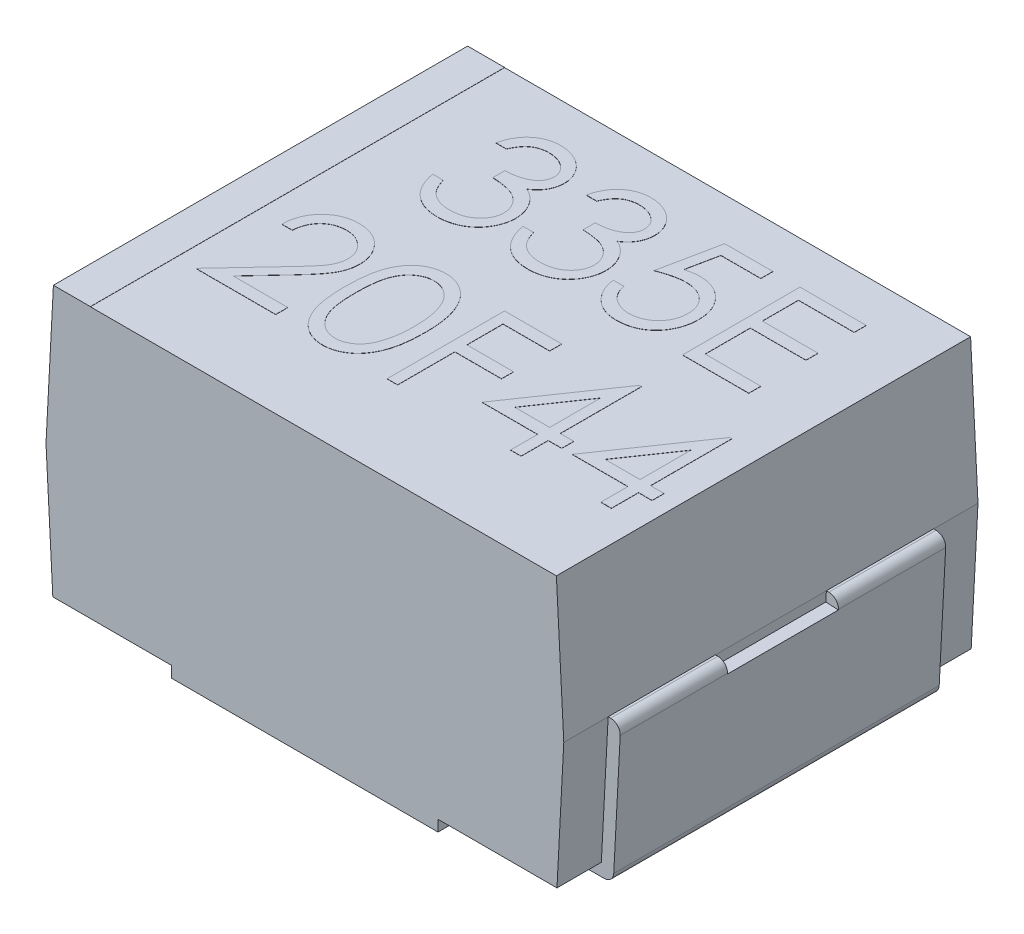
from build123d import *

# Parameters (mm, degrees)
BOSS_EXTRUDE1_DEPTH   = 1.4
CUT_EXTRUDE1_REACH    = 5.436
BOSS_EXTRUDE2_DEPTH   = 1.1
CUT_EXTRUDE2_REACH    = 5.98
SKETCH4_W             = 1.3
SKETCH4_H             = 1.2
SKETCH5_W             = 0.25
SKETCH5_H             = 2.8
BOSS_EXTRUDE3_DEPTH   = 0.00125
BOSS_EXTRUDE4_DEPTH   = 0.00125
BOSS_EXTRUDE4_2_DEPTH = 0.00125
BOSS_EXTRUDE4_3_DEPTH = 0.00125
BOSS_EXTRUDE4_4_DEPTH = 0.00125
BOSS_EXTRUDE5_DEPTH   = 0.00125
BOSS_EXTRUDE5_2_DEPTH = 0.00125
BOSS_EXTRUDE5_3_DEPTH = 0.00125
BOSS_EXTRUDE5_4_DEPTH = 0.00125
BOSS_EXTRUDE5_5_DEPTH = 0.00125
CUT_EXTRUDE3_REACH    = 5.98
SKETCH8_W             = 0.75
SKETCH8_H             = 0.135


with BuildPart() as part:
    # Sketch1 → Boss-Extrude1 (new, symmetric)
    with BuildSketch(Plane.XY):
        Polygon((-1.7, 0.95), (1.7, 0.95), (1.75, 0), (1.7, -0.95), (-1.7, -0.95), (-1.75, 0), align=None)
    extrude(amount=BOSS_EXTRUDE1_DEPTH, both=True)

    # Sketch2 → Cut-Extrude1 (cut, up to next)
    with BuildSketch(Plane.XY.offset(1.4), mode=Mode.PRIVATE) as cut_extrude1_sk1:
        Polygon((-1.7, -0.95), (-0.9, -0.95), (-0.9, -0.875), (-1.703947368, -0.875), align=None)
    cut_extrude1_tool1 = extrude(cut_extrude1_sk1.sketch, amount=-CUT_EXTRUDE1_REACH, mode=Mode.PRIVATE) & part.part
    # Sketch2 → Cut-Extrude1 (cut, up to next)
    with BuildSketch(Plane.XY.offset(1.4), mode=Mode.PRIVATE) as cut_extrude1_sk2:
        Polygon((1.7, -0.95), (0.9, -0.95), (0.9, -0.875), (1.703947368, -0.875), align=None)
    cut_extrude1_tool2 = extrude(cut_extrude1_sk2.sketch, amount=-CUT_EXTRUDE1_REACH, mode=Mode.PRIVATE) & part.part
    add(cut_extrude1_tool1.solids().sort_by_distance((-1.300988, -0.912469, 1.4))[0], mode=Mode.SUBTRACT)
    add(cut_extrude1_tool2.solids().sort_by_distance((1.300988, -0.912469, 1.4))[0], mode=Mode.SUBTRACT)

    # Sketch5 → Boss-Extrude3 (add)
    with BuildSketch(Plane(origin=(0, 0.95, 0), x_dir=(1, 0, 0), z_dir=(0, 1, 0))):
        with Locations((-1.575, 0)):
            Rectangle(SKETCH5_W, SKETCH5_H)
    extrude(amount=BOSS_EXTRUDE3_DEPTH)


with BuildPart() as body_2:
    # Sketch3 → Boss-Extrude2 (new, symmetric)
    with BuildSketch(Plane.XY):
        with BuildLine():
            Line((-1.75, 0), (-1.703947368, -0.875))
            Line((-1.703947368, -0.875), (-0.94, -0.875))
            Line((-0.94, -0.875), (-0.94, -0.895))
            ThreePointArc((-0.94, -0.895), (-0.959038059, -0.940961941), (-1.005, -0.96))
            Line((-1.005, -0.96), (-1.722804771, -0.96))
            ThreePointArc((-1.722804771, -0.96), (-1.767542557, -0.942154327), (-1.78771493, -0.898416324))
            Line((-1.78771493, -0.898416324), (-1.831399141, -0.068416324))
            ThreePointArc((-1.831399141, -0.068416324), (-1.813643309, -0.020262214), (-1.766488982, 0))
            Line((-1.766488982, 0), (-1.75, 0))
        make_face()
    extrude(amount=BOSS_EXTRUDE2_DEPTH, both=True)


with BuildPart() as body_3:
    # Mirror1: mirrored copy
    add(body_2.part.mirror(Plane(origin=(0, 0, 0), x_dir=(0, 0, 1), z_dir=(1, 0, 0))))

    # Cut-Extrude3: up to this face of the body (flat: up to its plane)
    cut_extrude3_end = Plane(body_3.part.faces().sort_by_distance((1.809557036, -0.483416324, 0))[0])
    # Sketch8 → Cut-Extrude3 (cut, up to the picked face)
    with BuildSketch(Plane(origin=(1.745165746, -0.091850829, 0), x_dir=(0, 0, -1), z_dir=(0.9986178293325098, -0.052558833122763125, 0)), mode=Mode.PRIVATE) as cut_extrude3_sk1:
        with Locations((0, 0.091977958)):
            Rectangle(SKETCH8_W, SKETCH8_H)
    cut_extrude3_tool1 = split(extrude(cut_extrude3_sk1.sketch, amount=CUT_EXTRUDE3_REACH, mode=Mode.PRIVATE), bisect_by=cut_extrude3_end, keep=Keep.BOTH, mode=Mode.PRIVATE)
    add(cut_extrude3_tool1.solids().sort_by(Axis((1.75, 0, 0), (0.9986178293325098, -0.052558833122763125, 0)))[0], mode=Mode.SUBTRACT)


with BuildPart() as body_2_1:
    add(body_2.part)

    # Cut-Extrude2: up to this face of the body (flat: up to its plane)
    cut_extrude2_end = Plane(body_2_1.part.faces().sort_by_distance((-1.809557036, -0.483416324, 0))[0])
    # Sketch4 → Cut-Extrude2 (cut, up to the picked face)
    with BuildSketch(Plane(origin=(-1.745165746, -0.091850829, 0), x_dir=(0, 0, 1), z_dir=(-0.9986178293325095, -0.052558833122767205, 0)), mode=Mode.PRIVATE) as cut_extrude2_sk1:
        with Locations((0, 0.091977958)):
            Rectangle(SKETCH4_W, SKETCH4_H)
    cut_extrude2_tool1 = split(extrude(cut_extrude2_sk1.sketch, amount=CUT_EXTRUDE2_REACH, mode=Mode.PRIVATE), bisect_by=cut_extrude2_end, keep=Keep.BOTH, mode=Mode.PRIVATE)
    add(cut_extrude2_tool1.solids().sort_by(Axis((-1.75, 0, 0), (-0.9986178293325095, -0.052558833122767205, 0)))[0], mode=Mode.SUBTRACT)


with BuildPart() as body_4:
    # Sketch6 → Boss-Extrude4 (new body)
    with BuildSketch(Plane(origin=(0, 0.95, 0), x_dir=(1, 0, 0), z_dir=(0, 1, 0))):
        with BuildLine():
            Line((-0.966810017, 0.929044549), (-1.038043992, 0.929044549))
            add(Edge.make_bspline(
                [(-1.038043992, 0.929044549), (-1.036114147, 0.937034773), (-1.032341459, 0.952655007), (-1.024472545, 0.974972368), (-1.015900214, 0.996091453), (-1.005606613, 1.015616812), (-0.994378735, 1.033940849), (-0.981514832, 1.050647954), (-0.967608395, 1.066163037), (-0.952226666, 1.079931932), (-0.936095701, 1.092400096), (-0.918988207, 1.103030689), (-0.901248372, 1.112175631), (-0.882753287, 1.119709505), (-0.863447887, 1.125384936), (-0.843506705, 1.12950264), (-0.822877482, 1.132176697), (-0.808874011, 1.132437673), (-0.801763443, 1.13257019)],
                knots=[0, 0, 0, 0, 1.162005537, 2.271625781, 3.343758855, 4.383309926, 5.390229558, 6.379919256, 7.361854164, 8.333198761, 9.295911338, 10.242430842, 11.177959212, 12.116337295, 13.062827104, 14.020064771, 14.994644689, 16, 16, 16, 16], degree=3))
            add(Edge.make_bspline(
                [(-0.801763443, 1.13257019), (-0.791403249, 1.1322574), (-0.770908849, 1.131638644), (-0.740800086, 1.125988405), (-0.711765433, 1.117047348), (-0.684122693, 1.104693485), (-0.658446369, 1.089456363), (-0.635600841, 1.071321503), (-0.615895768, 1.050638804), (-0.599364365, 1.027794097), (-0.58642057, 1.003379366), (-0.576875982, 0.978251473), (-0.571065351, 0.952470026), (-0.570312296, 0.935062571), (-0.569935017, 0.926341474)],
                knots=[0, 0, 0, 0, 1.083050992, 2.142477498, 3.193116406, 4.255571735, 5.30263384, 6.308962982, 7.297363603, 8.282367274, 9.249857812, 10.179914175, 11.08814088, 12, 12, 12, 12], degree=3))
            add(Edge.make_bspline(
                [(-0.569935017, 0.926341474), (-0.570198903, 0.917948862), (-0.570715287, 0.901525821), (-0.575099895, 0.877549696), (-0.582478655, 0.854952405), (-0.592699833, 0.83363882), (-0.605930863, 0.813744079), (-0.621958421, 0.795223422), (-0.640895632, 0.777994702), (-0.655246391, 0.768125107), (-0.662634587, 0.763043948)],
                knots=[0, 0, 0, 0, 1.024540389, 2.004866551, 2.965041327, 3.920577974, 4.882998113, 5.874504559, 6.905732034, 8, 8, 8, 8], degree=3))
            add(Edge.make_bspline(
                [(-0.662634587, 0.763043948), (-0.654190956, 0.758966755), (-0.637461683, 0.750888658), (-0.61465826, 0.73504637), (-0.593957741, 0.716754663), (-0.582413505, 0.702480168), (-0.576613202, 0.69530807)],
                knots=[0, 0, 0, 0, 1.015518401, 2.012035669, 3.001164323, 4, 4, 4, 4], degree=3))
            add(Edge.make_bspline(
                [(-0.576613202, 0.69530807), (-0.572793826, 0.690078902), (-0.56521762, 0.679706196), (-0.55586599, 0.663029185), (-0.547382137, 0.646167329), (-0.540771284, 0.628668678), (-0.535651853, 0.610736048), (-0.531992432, 0.592338648), (-0.5297191, 0.573461453), (-0.529393537, 0.560690587), (-0.529229889, 0.554271161)],
                knots=[0, 0, 0, 0, 1.025084078, 2.033381695, 3.024893161, 4.013698104, 4.991890475, 5.976764909, 6.982997093, 8, 8, 8, 8], degree=3))
            add(Edge.make_bspline(
                [(-0.529229889, 0.554271161), (-0.529636859, 0.543156457), (-0.530448884, 0.520979353), (-0.537706951, 0.488214551), (-0.548958525, 0.456186624), (-0.564937152, 0.42555358), (-0.584410676, 0.396892315), (-0.607578498, 0.371248224), (-0.634177379, 0.349204969), (-0.663842232, 0.330787649), (-0.695981652, 0.316065192), (-0.730356831, 0.305846808), (-0.766472468, 0.299191554), (-0.791239123, 0.298477889), (-0.8038305, 0.298115062)],
                knots=[0, 0, 0, 0, 0.955779014, 1.907060117, 2.875433937, 3.871313158, 4.872415639, 5.851225146, 6.836215519, 7.83643374, 8.849228613, 9.86973379, 10.916971861, 12, 12, 12, 12], degree=3))
            add(Edge.make_bspline(
                [(-0.8038305, 0.298115062), (-0.812316663, 0.29831196), (-0.829014601, 0.29869939), (-0.85356268, 0.30134793), (-0.876994566, 0.306185271), (-0.899341939, 0.31269477), (-0.920624652, 0.320947898), (-0.940777762, 0.331225531), (-0.959925256, 0.343315818), (-0.977886446, 0.357361471), (-0.994659193, 0.373073489), (-1.009797757, 0.3907308), (-1.023554532, 0.410006997), (-1.035561166, 0.431125976), (-1.046364546, 0.453814811), (-1.055250227, 0.478364024), (-1.063071062, 0.504554151), (-1.066707222, 0.522805352), (-1.068572838, 0.532169549)],
                knots=[0, 0, 0, 0, 1.048658725, 2.063410685, 3.046034179, 4.001477787, 4.936774919, 5.862367409, 6.792675028, 7.730719943, 8.675894397, 9.627829632, 10.600096036, 11.597688215, 12.626045268, 13.701542398, 14.82072376, 16, 16, 16, 16], degree=3))
            Line((-1.068572838, 0.532169549), (-0.997338863, 0.532169549))
            add(Edge.make_bspline(
                [(-0.997338863, 0.532169549), (-0.99548301, 0.526057898), (-0.991873213, 0.514170205), (-0.985728614, 0.497061421), (-0.97872813, 0.481377363), (-0.971218222, 0.467002976), (-0.963330967, 0.453796699), (-0.954505618, 0.44210774), (-0.94539583, 0.431422685), (-0.938528905, 0.425402746), (-0.93516814, 0.422456508)],
                knots=[0, 0, 0, 0, 1.198163088, 2.33053128, 3.407730985, 4.417276592, 5.372219308, 6.28897303, 7.162600585, 8, 8, 8, 8], degree=3))
            add(Edge.make_bspline(
                [(-0.93516814, 0.422456508), (-0.930723917, 0.419030154), (-0.921849188, 0.412188021), (-0.907387464, 0.403456402), (-0.892178106, 0.395890598), (-0.875891564, 0.39011126), (-0.858879285, 0.385217755), (-0.840866294, 0.382015423), (-0.822011507, 0.379818284), (-0.809137389, 0.379624398), (-0.802558465, 0.379525318)],
                knots=[0, 0, 0, 0, 0.946170439, 1.889420265, 2.845303464, 3.807233317, 4.801018734, 5.828864929, 6.890507805, 8, 8, 8, 8], degree=3))
            add(Edge.make_bspline(
                [(-0.802558465, 0.379525318), (-0.795130438, 0.379664997), (-0.780605574, 0.379938126), (-0.759411347, 0.382449938), (-0.739248408, 0.386108085), (-0.720340619, 0.391757994), (-0.702440308, 0.398738651), (-0.685798398, 0.407503557), (-0.670196424, 0.417787093), (-0.655834219, 0.429475437), (-0.642919792, 0.442271027), (-0.631548866, 0.455654348), (-0.621882202, 0.469568974), (-0.614084498, 0.484091905), (-0.607927141, 0.499163001), (-0.603735415, 0.514824557), (-0.600820875, 0.530948401), (-0.600583518, 0.541908721), (-0.600463863, 0.547433972)],
                knots=[0, 0, 0, 0, 1.217147791, 2.380027433, 3.494444702, 4.572153297, 5.609568379, 6.639424714, 7.649109417, 8.668170816, 9.669597737, 10.625200337, 11.543417969, 12.441394052, 13.322311151, 14.205496177, 15.095365482, 16, 16, 16, 16], degree=3))
            add(Edge.make_bspline(
                [(-0.600463863, 0.547433972), (-0.600810914, 0.554829758), (-0.601503288, 0.569584529), (-0.606789341, 0.591291907), (-0.615484048, 0.61220686), (-0.627656206, 0.631972548), (-0.642473416, 0.650291368), (-0.659791886, 0.666636151), (-0.679755431, 0.680123118), (-0.69812958, 0.689441438), (-0.714404892, 0.695799846), (-0.728333024, 0.700035062), (-0.743926039, 0.703621373), (-0.760995372, 0.706957906), (-0.779669637, 0.709797569), (-0.799928504, 0.712165623), (-0.821776079, 0.714060427), (-0.836900683, 0.714906586), (-0.844694633, 0.715342626)],
                knots=[0, 0, 0, 0, 1.07054697, 2.135767047, 3.216561865, 4.33974944, 5.486079747, 6.621378074, 7.775625952, 8.963672916, 9.598146892, 10.304877434, 11.070270905, 11.915000392, 12.823868403, 13.805723172, 14.86925407, 16, 16, 16, 16], degree=3))
            Line((-0.844694633, 0.715342626), (-0.844694633, 0.796752882))
            add(Edge.make_bspline(
                [(-0.844694633, 0.796752882), (-0.834874547, 0.796919525), (-0.815639411, 0.797245938), (-0.787541953, 0.801193826), (-0.760673898, 0.806654968), (-0.73563069, 0.815020003), (-0.712805, 0.82473557), (-0.693002162, 0.836041339), (-0.676499612, 0.848608613), (-0.663377548, 0.862631365), (-0.653505741, 0.877670671), (-0.646287878, 0.893345341), (-0.642024232, 0.909792762), (-0.641455076, 0.921017446), (-0.641168992, 0.926659483)],
                knots=[0, 0, 0, 0, 1.321986639, 2.589447074, 3.816329219, 5.01088745, 6.139805852, 7.153945165, 8.075214402, 8.924034688, 9.728124013, 10.488707548, 11.240355623, 12, 12, 12, 12], degree=3))
            add(Edge.make_bspline(
                [(-0.641168992, 0.926659483), (-0.641262974, 0.930804614), (-0.641449948, 0.939051157), (-0.643807902, 0.951099163), (-0.647351211, 0.962778842), (-0.652222507, 0.974040524), (-0.658742641, 0.984806104), (-0.666545427, 0.995167365), (-0.675836407, 1.00506515), (-0.686482964, 1.014290866), (-0.697915641, 1.023083175), (-0.710445501, 1.030547518), (-0.723694748, 1.036930416), (-0.73767805, 1.042193999), (-0.752440786, 1.046153516), (-0.767913595, 1.048996466), (-0.78412598, 1.050773934), (-0.795186712, 1.051029843), (-0.800809416, 1.051159933)],
                knots=[0, 0, 0, 0, 0.884392785, 1.759457502, 2.611959086, 3.489218968, 4.37281399, 5.2945488, 6.255912374, 7.266815255, 8.301784654, 9.332968512, 10.37626691, 11.440494194, 12.520033166, 13.637162961, 14.798855837, 16, 16, 16, 16], degree=3))
            add(Edge.make_bspline(
                [(-0.800809416, 1.051159933), (-0.809847205, 1.050844392), (-0.827500109, 1.050228067), (-0.852948849, 1.044829884), (-0.876606984, 1.036216997), (-0.894690574, 1.025936116), (-0.908044301, 1.015787357), (-0.91758675, 1.00692403), (-0.926957651, 0.997074086), (-0.93554051, 0.985630847), (-0.944220501, 0.973369272), (-0.95212275, 0.959666044), (-0.959801644, 0.944878619), (-0.964428651, 0.934424787), (-0.966810017, 0.929044549)],
                knots=[0, 0, 0, 0, 1.472543308, 2.876219568, 4.221790263, 5.565193594, 6.249813518, 6.953379497, 7.687249741, 8.463570142, 9.283606569, 10.136032583, 11.040678096, 12, 12, 12, 12], degree=3))
        make_face()
    extrude(amount=BOSS_EXTRUDE4_DEPTH)


with BuildPart() as body_5:
    # Sketch6 → Boss-Extrude4 2 (new body)
    with BuildSketch(Plane(origin=(0, 0.95, 0), x_dir=(1, 0, 0), z_dir=(0, 1, 0))):
        with BuildLine():
            Line((-0.356233094, 0.929044549), (-0.427467069, 0.929044549))
            add(Edge.make_bspline(
                [(-0.427467069, 0.929044549), (-0.425537224, 0.937034773), (-0.421764536, 0.952655007), (-0.413895622, 0.974972368), (-0.405323291, 0.996091453), (-0.39502969, 1.015616812), (-0.383801812, 1.033940849), (-0.370937909, 1.050647954), (-0.357031472, 1.066163037), (-0.341649742, 1.079931932), (-0.325518778, 1.092400096), (-0.308411284, 1.103030689), (-0.290671449, 1.112175631), (-0.272176364, 1.119709505), (-0.252870964, 1.125384936), (-0.232929782, 1.12950264), (-0.212300559, 1.132176697), (-0.198297088, 1.132437673), (-0.19118652, 1.13257019)],
                knots=[0, 0, 0, 0, 1.162005537, 2.271625781, 3.343758855, 4.383309926, 5.390229558, 6.379919256, 7.361854164, 8.333198761, 9.295911338, 10.242430842, 11.177959212, 12.116337295, 13.062827104, 14.020064771, 14.994644689, 16, 16, 16, 16], degree=3))
            add(Edge.make_bspline(
                [(-0.19118652, 1.13257019), (-0.180826326, 1.1322574), (-0.160331926, 1.131638644), (-0.130223163, 1.125988405), (-0.10118851, 1.117047348), (-0.073545769, 1.104693485), (-0.047869446, 1.089456363), (-0.025023918, 1.071321503), (-0.005318845, 1.050638804), (0.011212558, 1.027794097), (0.024156353, 1.003379366), (0.033700941, 0.978251473), (0.039511572, 0.952470026), (0.040264627, 0.935062571), (0.040641906, 0.926341474)],
                knots=[0, 0, 0, 0, 1.083050992, 2.142477498, 3.193116406, 4.255571735, 5.30263384, 6.308962982, 7.297363603, 8.282367274, 9.249857812, 10.179914175, 11.08814088, 12, 12, 12, 12], degree=3))
            add(Edge.make_bspline(
                [(0.040641906, 0.926341474), (0.04037802, 0.917948862), (0.039861636, 0.901525821), (0.035477028, 0.877549696), (0.028098269, 0.854952405), (0.01787709, 0.83363882), (0.00464606, 0.813744079), (-0.011381498, 0.795223422), (-0.030318709, 0.777994702), (-0.044669468, 0.768125107), (-0.052057663, 0.763043948)],
                knots=[0, 0, 0, 0, 1.024540389, 2.004866551, 2.965041327, 3.920577974, 4.882998113, 5.874504559, 6.905732034, 8, 8, 8, 8], degree=3))
            add(Edge.make_bspline(
                [(-0.052057663, 0.763043948), (-0.043614033, 0.758966755), (-0.02688476, 0.750888658), (-0.004081336, 0.73504637), (0.016619182, 0.716754663), (0.028163418, 0.702480168), (0.033963721, 0.69530807)],
                knots=[0, 0, 0, 0, 1.015518401, 2.012035669, 3.001164323, 4, 4, 4, 4], degree=3))
            add(Edge.make_bspline(
                [(0.033963721, 0.69530807), (0.037783097, 0.690078902), (0.045359303, 0.679706196), (0.054710933, 0.663029185), (0.063194786, 0.646167329), (0.069805639, 0.628668678), (0.07492507, 0.610736048), (0.078584492, 0.592338648), (0.080857823, 0.573461453), (0.081183386, 0.560690587), (0.081347034, 0.554271161)],
                knots=[0, 0, 0, 0, 1.025084078, 2.033381695, 3.024893161, 4.013698104, 4.991890475, 5.976764909, 6.982997093, 8, 8, 8, 8], degree=3))
            add(Edge.make_bspline(
                [(0.081347034, 0.554271161), (0.080940064, 0.543156457), (0.080128039, 0.520979353), (0.072869972, 0.488214551), (0.061618398, 0.456186624), (0.045639772, 0.42555358), (0.026166247, 0.396892315), (0.002998425, 0.371248224), (-0.023600456, 0.349204969), (-0.053265309, 0.330787649), (-0.085404729, 0.316065192), (-0.119779908, 0.305846808), (-0.155895545, 0.299191554), (-0.1806622, 0.298477889), (-0.193253577, 0.298115062)],
                knots=[0, 0, 0, 0, 0.955779014, 1.907060117, 2.875433937, 3.871313158, 4.872415639, 5.851225146, 6.836215519, 7.83643374, 8.849228613, 9.86973379, 10.916971861, 12, 12, 12, 12], degree=3))
            add(Edge.make_bspline(
                [(-0.193253577, 0.298115062), (-0.20173974, 0.29831196), (-0.218437678, 0.29869939), (-0.242985757, 0.30134793), (-0.266417643, 0.306185271), (-0.288765016, 0.31269477), (-0.310047729, 0.320947898), (-0.330200839, 0.331225531), (-0.349348333, 0.343315818), (-0.367309523, 0.357361471), (-0.38408227, 0.373073489), (-0.399220834, 0.3907308), (-0.412977609, 0.410006997), (-0.424984243, 0.431125976), (-0.435787623, 0.453814811), (-0.444673304, 0.478364024), (-0.452494139, 0.504554151), (-0.456130299, 0.522805352), (-0.457995915, 0.532169549)],
                knots=[0, 0, 0, 0, 1.048658725, 2.063410685, 3.046034179, 4.001477787, 4.936774919, 5.862367409, 6.792675028, 7.730719943, 8.675894397, 9.627829632, 10.600096036, 11.597688215, 12.626045268, 13.701542398, 14.82072376, 16, 16, 16, 16], degree=3))
            Line((-0.457995915, 0.532169549), (-0.38676194, 0.532169549))
            add(Edge.make_bspline(
                [(-0.38676194, 0.532169549), (-0.384906087, 0.526057898), (-0.38129629, 0.514170205), (-0.375151691, 0.497061421), (-0.368151207, 0.481377363), (-0.360641299, 0.467002976), (-0.352754044, 0.453796699), (-0.343928695, 0.44210774), (-0.334818906, 0.431422685), (-0.327951982, 0.425402746), (-0.324591217, 0.422456508)],
                knots=[0, 0, 0, 0, 1.198163088, 2.33053128, 3.407730985, 4.417276592, 5.372219308, 6.28897303, 7.162600585, 8, 8, 8, 8], degree=3))
            add(Edge.make_bspline(
                [(-0.324591217, 0.422456508), (-0.320146994, 0.419030154), (-0.311272265, 0.412188021), (-0.296810541, 0.403456402), (-0.281601183, 0.395890598), (-0.265314641, 0.39011126), (-0.248302362, 0.385217755), (-0.23028937, 0.382015423), (-0.211434584, 0.379818284), (-0.198560466, 0.379624398), (-0.191981542, 0.379525318)],
                knots=[0, 0, 0, 0, 0.946170439, 1.889420265, 2.845303464, 3.807233317, 4.801018734, 5.828864929, 6.890507805, 8, 8, 8, 8], degree=3))
            add(Edge.make_bspline(
                [(-0.191981542, 0.379525318), (-0.184553515, 0.379664997), (-0.170028651, 0.379938126), (-0.148834424, 0.382449938), (-0.128671485, 0.386108085), (-0.109763696, 0.391757994), (-0.091863385, 0.398738651), (-0.075221475, 0.407503557), (-0.059619501, 0.417787093), (-0.045257296, 0.429475437), (-0.032342869, 0.442271027), (-0.020971943, 0.455654348), (-0.011305279, 0.469568974), (-0.003507575, 0.484091905), (0.002649782, 0.499163001), (0.006841508, 0.514824557), (0.009756048, 0.530948401), (0.009993405, 0.541908721), (0.01011306, 0.547433972)],
                knots=[0, 0, 0, 0, 1.217147791, 2.380027433, 3.494444702, 4.572153297, 5.609568379, 6.639424714, 7.649109417, 8.668170816, 9.669597737, 10.625200337, 11.543417969, 12.441394052, 13.322311151, 14.205496177, 15.095365482, 16, 16, 16, 16], degree=3))
            add(Edge.make_bspline(
                [(0.01011306, 0.547433972), (0.009766009, 0.554829758), (0.009073635, 0.569584529), (0.003787582, 0.591291907), (-0.004907125, 0.61220686), (-0.017079283, 0.631972548), (-0.031896493, 0.650291368), (-0.049214963, 0.666636151), (-0.069178508, 0.680123118), (-0.087552657, 0.689441438), (-0.103827969, 0.695799846), (-0.117756101, 0.700035062), (-0.133349116, 0.703621373), (-0.150418449, 0.706957906), (-0.169092714, 0.709797569), (-0.189351581, 0.712165623), (-0.211199156, 0.714060427), (-0.226323759, 0.714906586), (-0.23411771, 0.715342626)],
                knots=[0, 0, 0, 0, 1.07054697, 2.135767047, 3.216561865, 4.33974944, 5.486079747, 6.621378074, 7.775625952, 8.963672916, 9.598146892, 10.304877434, 11.070270905, 11.915000392, 12.823868403, 13.805723172, 14.86925407, 16, 16, 16, 16], degree=3))
            Line((-0.23411771, 0.715342626), (-0.23411771, 0.796752882))
            add(Edge.make_bspline(
                [(-0.23411771, 0.796752882), (-0.224297624, 0.796919525), (-0.205062488, 0.797245938), (-0.17696503, 0.801193826), (-0.150096975, 0.806654968), (-0.125053767, 0.815020003), (-0.102228077, 0.82473557), (-0.082425239, 0.836041339), (-0.065922689, 0.848608613), (-0.052800625, 0.862631365), (-0.042928818, 0.877670671), (-0.035710955, 0.893345341), (-0.031447309, 0.909792762), (-0.030878153, 0.921017446), (-0.030592069, 0.926659483)],
                knots=[0, 0, 0, 0, 1.321986639, 2.589447074, 3.816329219, 5.01088745, 6.139805852, 7.153945165, 8.075214402, 8.924034688, 9.728124013, 10.488707548, 11.240355623, 12, 12, 12, 12], degree=3))
            add(Edge.make_bspline(
                [(-0.030592069, 0.926659483), (-0.030686051, 0.930804614), (-0.030873025, 0.939051157), (-0.033230979, 0.951099163), (-0.036774288, 0.962778842), (-0.041645584, 0.974040524), (-0.048165718, 0.984806104), (-0.055968504, 0.995167365), (-0.065259484, 1.00506515), (-0.075906041, 1.014290866), (-0.087338718, 1.023083175), (-0.099868578, 1.030547518), (-0.113117824, 1.036930416), (-0.127101127, 1.042193999), (-0.141863863, 1.046153516), (-0.157336672, 1.048996466), (-0.173549057, 1.050773934), (-0.184609789, 1.051029843), (-0.190232493, 1.051159933)],
                knots=[0, 0, 0, 0, 0.884392785, 1.759457502, 2.611959086, 3.489218968, 4.37281399, 5.2945488, 6.255912374, 7.266815255, 8.301784654, 9.332968512, 10.37626691, 11.440494194, 12.520033166, 13.637162961, 14.798855837, 16, 16, 16, 16], degree=3))
            add(Edge.make_bspline(
                [(-0.190232493, 1.051159933), (-0.199270282, 1.050844392), (-0.216923186, 1.050228067), (-0.242371926, 1.044829884), (-0.266030061, 1.036216997), (-0.284113651, 1.025936116), (-0.297467378, 1.015787357), (-0.307009826, 1.00692403), (-0.316380728, 0.997074086), (-0.324963587, 0.985630847), (-0.333643578, 0.973369272), (-0.341545827, 0.959666044), (-0.349224721, 0.944878619), (-0.353851728, 0.934424787), (-0.356233094, 0.929044549)],
                knots=[0, 0, 0, 0, 1.472543308, 2.876219568, 4.221790263, 5.565193594, 6.249813518, 6.953379497, 7.687249741, 8.463570142, 9.283606569, 10.136032583, 11.040678096, 12, 12, 12, 12], degree=3))
        make_face()
    extrude(amount=BOSS_EXTRUDE4_2_DEPTH)


with BuildPart() as body_6:
    # Sketch6 → Boss-Extrude4 3 (new body)
    with BuildSketch(Plane(origin=(0, 0.95, 0), x_dir=(1, 0, 0), z_dir=(0, 1, 0))):
        with BuildLine():
            Line((0.651218829, 1.112217626), (0.651218829, 1.030807369))
            Line((0.651218829, 1.030807369), (0.381229346, 1.030807369))
            Line((0.381229346, 1.030807369), (0.33845716, 0.822034583))
            add(Edge.make_bspline(
                [(0.33845716, 0.822034583), (0.346860903, 0.824354662), (0.363141826, 0.828849449), (0.387172009, 0.833840044), (0.409984883, 0.836848457), (0.424788405, 0.837259236), (0.431951752, 0.83745801)],
                knots=[0, 0, 0, 0, 1.100273476, 2.13160584, 3.095893838, 4, 4, 4, 4], degree=3))
            add(Edge.make_bspline(
                [(0.431951752, 0.83745801), (0.440815385, 0.837266164), (0.458243504, 0.836888947), (0.483743051, 0.833266759), (0.508084618, 0.827565386), (0.531217298, 0.819600553), (0.553183887, 0.809415667), (0.573782281, 0.796693002), (0.593321665, 0.781830979), (0.611451503, 0.764743807), (0.62789898, 0.745938369), (0.642360195, 0.725718637), (0.654643497, 0.704281114), (0.664522454, 0.681420976), (0.672411044, 0.657390953), (0.677661586, 0.631938207), (0.681157875, 0.605302651), (0.681548488, 0.587090722), (0.681747675, 0.577803814)],
                knots=[0, 0, 0, 0, 1.052922333, 2.070308379, 3.05430497, 4.020497103, 4.973039431, 5.925935799, 6.892292201, 7.88610001, 8.88166317, 9.857072816, 10.836096531, 11.812156883, 12.81219415, 13.836441305, 14.89672472, 16, 16, 16, 16], degree=3))
            add(Edge.make_bspline(
                [(0.681747675, 0.577803814), (0.681596846, 0.571335382), (0.681297225, 0.558485933), (0.679773545, 0.53940323), (0.676839909, 0.520724516), (0.672901158, 0.502447313), (0.667788859, 0.484606223), (0.661600092, 0.46715018), (0.65402635, 0.450187832), (0.645718877, 0.43355868), (0.636364765, 0.417638661), (0.625982854, 0.402750409), (0.615014251, 0.388670581), (0.603212008, 0.375550181), (0.590466426, 0.363475425), (0.576931862, 0.352374654), (0.562716317, 0.342060138), (0.54759986, 0.332950565), (0.531919332, 0.324567894), (0.51544829, 0.317690949), (0.498561667, 0.311542669), (0.481016419, 0.306641937), (0.462852286, 0.302801875), (0.444039328, 0.300193703), (0.424676212, 0.298294047), (0.411550986, 0.29817513), (0.404921002, 0.298115062)],
                knots=[0, 0, 0, 0, 1.056347294, 2.098418968, 3.122841568, 4.141288669, 5.149314143, 6.15115421, 7.162517403, 8.180376062, 9.185164535, 10.17417709, 11.141909838, 12.097768115, 13.052685741, 14.0056014, 14.954263652, 15.917497458, 16.885230207, 17.854509472, 18.828990115, 19.81800267, 20.826176721, 21.857883937, 22.917946725, 24, 24, 24, 24], degree=3))
            add(Edge.make_bspline(
                [(0.404921002, 0.298115062), (0.397012036, 0.298271734), (0.38145208, 0.298579968), (0.358655452, 0.301804517), (0.336721961, 0.306422762), (0.31582817, 0.313370631), (0.29578683, 0.322076321), (0.276867749, 0.333079095), (0.258587511, 0.345547571), (0.241689245, 0.360261508), (0.226005626, 0.376344172), (0.211966115, 0.393797065), (0.199462607, 0.412332135), (0.188695332, 0.432039395), (0.17951096, 0.452867062), (0.172295775, 0.474893171), (0.166472291, 0.498002636), (0.164008622, 0.51391245), (0.16275729, 0.521993267)],
                knots=[0, 0, 0, 0, 1.0467383, 2.05933395, 3.04377827, 4.011590433, 4.970194871, 5.932262533, 6.905835911, 7.896367577, 8.894135286, 9.877477877, 10.858688626, 11.851381753, 12.8477658, 13.868841284, 14.917554742, 16, 16, 16, 16], degree=3))
            Line((0.16275729, 0.521993267), (0.233991265, 0.521993267))
            add(Edge.make_bspline(
                [(0.233991265, 0.521993267), (0.235743991, 0.514423964), (0.239112829, 0.499875344), (0.246507347, 0.479434844), (0.255548358, 0.461219591), (0.266298987, 0.444988632), (0.279123726, 0.430835163), (0.293758078, 0.418222008), (0.310165509, 0.406843005), (0.328397545, 0.397358199), (0.347631939, 0.389269035), (0.367763074, 0.38388249), (0.38824281, 0.380094966), (0.402094512, 0.379715835), (0.409055117, 0.379525318)],
                knots=[0, 0, 0, 0, 1.136247022, 2.183929868, 3.172523383, 4.106158343, 5.02341133, 5.958108904, 6.928429099, 7.938127109, 8.96079061, 9.975095812, 10.982467395, 12, 12, 12, 12], degree=3))
            add(Edge.make_bspline(
                [(0.409055117, 0.379525318), (0.415849264, 0.379711459), (0.429226996, 0.380077971), (0.448914578, 0.382898962), (0.467922141, 0.387243625), (0.48606213, 0.393745539), (0.50365198, 0.401647823), (0.520246745, 0.411788563), (0.536326505, 0.42345896), (0.551391457, 0.436829482), (0.565188975, 0.45156368), (0.577380095, 0.467320161), (0.587534859, 0.484128803), (0.596092416, 0.501698607), (0.602590575, 0.520222137), (0.607226297, 0.539612582), (0.60994842, 0.559917836), (0.610322884, 0.573767484), (0.610513701, 0.580824897)],
                knots=[0, 0, 0, 0, 1.027316725, 2.022795036, 3.002884548, 3.971462791, 4.93288096, 5.914575861, 6.907176829, 7.935150275, 8.956128384, 9.956726525, 10.942570165, 11.921478529, 12.907843606, 13.90538589, 14.932640048, 16, 16, 16, 16], degree=3))
            add(Edge.make_bspline(
                [(0.610513701, 0.580824897), (0.610364367, 0.587192077), (0.610072067, 0.599654924), (0.607683885, 0.617888316), (0.603529857, 0.635140595), (0.597764084, 0.651495073), (0.590443553, 0.666967175), (0.581497693, 0.681572869), (0.570758619, 0.695119649), (0.558491351, 0.707613853), (0.545052474, 0.719144745), (0.530210768, 0.728974564), (0.51427682, 0.73724406), (0.497442608, 0.744380552), (0.479307711, 0.749506079), (0.46023126, 0.753354153), (0.440007257, 0.755580137), (0.426179976, 0.755888994), (0.419072395, 0.756047754)],
                knots=[0, 0, 0, 0, 1.045622112, 2.046656509, 3.013763289, 3.955457236, 4.890082067, 5.820317437, 6.762574623, 7.722996705, 8.69280354, 9.665887285, 10.63943826, 11.638615906, 12.663482002, 13.728887084, 14.832589034, 16, 16, 16, 16], degree=3))
            add(Edge.make_bspline(
                [(0.419072395, 0.756047754), (0.412919941, 0.755916084), (0.400216686, 0.755644219), (0.380730616, 0.753642496), (0.360253743, 0.750413228), (0.338864563, 0.745971346), (0.31649884, 0.740158584), (0.293203775, 0.733192974), (0.268930386, 0.72486495), (0.252575116, 0.71857568), (0.244167547, 0.715342626)],
                knots=[0, 0, 0, 0, 0.817624296, 1.688186739, 2.600797293, 3.572016777, 4.590301741, 5.671205678, 6.80286297, 8, 8, 8, 8], degree=3))
            Line((0.244167547, 0.715342626), (0.325577803, 1.112217626))
            Line((0.325577803, 1.112217626), (0.651218829, 1.112217626))
        make_face()
    extrude(amount=BOSS_EXTRUDE4_3_DEPTH)


with BuildPart() as body_7:
    # Sketch6 → Boss-Extrude4 4 (new body)
    with BuildSketch(Plane(origin=(0, 0.95, 0), x_dir=(1, 0, 0), z_dir=(0, 1, 0))):
        Polygon((0.834391906, 1.112217626), (1.282148316, 1.112217626), (1.282148316, 1.030807369), (0.90562588, 1.030807369), (0.90562588, 0.7865766), (1.282148316, 0.7865766), (1.282148316, 0.705166344), (0.90562588, 0.705166344), (0.90562588, 0.399877882), (1.282148316, 0.399877882), (1.282148316, 0.318467626), (0.834391906, 0.318467626), align=None)
    extrude(amount=BOSS_EXTRUDE4_4_DEPTH)


with BuildPart() as body_8:
    # Sketch7 → Boss-Extrude5 (new body)
    with BuildSketch(Plane(origin=(0, 0.95, 0), x_dir=(1, 0, 0), z_dir=(0, 1, 0))):
        with BuildLine():
            Line((-1.215370115, -0.269952343), (-1.28660409, -0.269952343))
            add(Edge.make_bspline(
                [(-1.28660409, -0.269952343), (-1.286139825, -0.260501981), (-1.28522802, -0.241941721), (-1.280958033, -0.214880764), (-1.274848227, -0.189014765), (-1.26620963, -0.164551409), (-1.255481242, -0.141274394), (-1.242615682, -0.119276176), (-1.227377077, -0.098640675), (-1.210094478, -0.079559187), (-1.191323733, -0.062054148), (-1.171070422, -0.046937692), (-1.14978771, -0.034165648), (-1.127540168, -0.023488295), (-1.10407679, -0.015473723), (-1.079610499, -0.00952703), (-1.054033802, -0.00594918), (-1.036607583, -0.0055646), (-1.027744915, -0.005369009)],
                knots=[0, 0, 0, 0, 1.10065271, 2.161652631, 3.183658789, 4.190468796, 5.17591951, 6.163126047, 7.15150782, 8.156236427, 9.156009102, 10.134482811, 11.092018607, 12.041330605, 13.001268258, 13.972401359, 14.968799086, 16, 16, 16, 16], degree=3))
            add(Edge.make_bspline(
                [(-1.027744915, -0.005369009), (-1.019041316, -0.005572766), (-1.001939055, -0.005973142), (-0.976978562, -0.009411447), (-0.953216569, -0.014796608), (-0.930699522, -0.022352068), (-0.909607075, -0.032508537), (-0.889780777, -0.04470905), (-0.870984594, -0.058819619), (-0.854064841, -0.075432537), (-0.838528187, -0.093167721), (-0.82512464, -0.112101585), (-0.813646298, -0.131657155), (-0.804078735, -0.15198355), (-0.797035646, -0.173272159), (-0.791688445, -0.195213042), (-0.788665978, -0.218033312), (-0.788202105, -0.233478906), (-0.787966269, -0.241331549)],
                knots=[0, 0, 0, 0, 1.111607364, 2.184268762, 3.212621178, 4.221274766, 5.211760367, 6.196651075, 7.1921475, 8.207485113, 9.220403448, 10.201281604, 11.166441695, 12.114753415, 13.065576456, 14.026450734, 14.996634279, 16, 16, 16, 16], degree=3))
            add(Edge.make_bspline(
                [(-0.787966269, -0.241331549), (-0.788350277, -0.252386862), (-0.789111554, -0.274303482), (-0.795623564, -0.306510424), (-0.805794112, -0.337714646), (-0.818039941, -0.362828284), (-0.830393514, -0.383065166), (-0.841525859, -0.399726818), (-0.854558057, -0.417666808), (-0.869679788, -0.436825062), (-0.886578243, -0.457351642), (-0.905406484, -0.479234149), (-0.926298773, -0.502246497), (-0.940962398, -0.517964017), (-0.94856072, -0.526108442)],
                knots=[0, 0, 0, 0, 1.184426356, 2.348067706, 3.509069118, 4.696110526, 5.333549288, 6.050745305, 6.844228056, 7.710549037, 8.667450064, 9.695053472, 10.805634456, 12, 12, 12, 12], degree=3))
            Line((-0.94856072, -0.526108442), (-1.147157225, -0.738061317))
            Line((-1.147157225, -0.738061317), (-0.777789987, -0.738061317))
            Line((-0.777789987, -0.738061317), (-0.777789987, -0.819471574))
            Line((-0.777789987, -0.819471574), (-1.317132936, -0.819471574))
            Line((-1.317132936, -0.819471574), (-1.009300404, -0.490968469))
            add(Edge.make_bspline(
                [(-1.009300404, -0.490968469), (-1.001805615, -0.483144745), (-0.98740966, -0.468116975), (-0.967048254, -0.446177053), (-0.948760484, -0.42582314), (-0.932427968, -0.40709369), (-0.918405012, -0.389714745), (-0.905960774, -0.374249161), (-0.895990006, -0.360017348), (-0.885168836, -0.343520816), (-0.874688165, -0.323379451), (-0.86568197, -0.298765561), (-0.860190388, -0.273427416), (-0.859531613, -0.256304633), (-0.859200244, -0.247691726)],
                knots=[0, 0, 0, 0, 1.329631726, 2.553950428, 3.673215718, 4.687767853, 5.603093632, 6.413772471, 7.123043292, 7.734684054, 8.834405432, 9.900288307, 10.943827018, 12, 12, 12, 12], degree=3))
            add(Edge.make_bspline(
                [(-0.859200244, -0.247691726), (-0.859344421, -0.242275766), (-0.859628567, -0.231601949), (-0.862136294, -0.215952428), (-0.865925998, -0.200856479), (-0.871356441, -0.186267668), (-0.878524398, -0.172332671), (-0.887249611, -0.159034529), (-0.897316643, -0.146178281), (-0.908962377, -0.134123873), (-0.921755704, -0.123083671), (-0.935270829, -0.113303744), (-0.949569692, -0.105130589), (-0.964592005, -0.098430545), (-0.980295888, -0.0931747), (-0.996711714, -0.089532844), (-1.013794125, -0.08724628), (-1.025458507, -0.086936906), (-1.031402016, -0.086779266)],
                knots=[0, 0, 0, 0, 0.991446411, 1.95395049, 2.89581595, 3.838931463, 4.798493298, 5.75982156, 6.748411868, 7.785213223, 8.824556874, 9.840280684, 10.836137867, 11.835679398, 12.848801643, 13.863922112, 14.911575587, 16, 16, 16, 16], degree=3))
            add(Edge.make_bspline(
                [(-1.031402016, -0.086779266), (-1.03760933, -0.086941425), (-1.04979947, -0.087259879), (-1.067697179, -0.089487518), (-1.084770918, -0.093330593), (-1.101063635, -0.098586732), (-1.116602898, -0.10526751), (-1.131313137, -0.113588673), (-1.145161328, -0.123518144), (-1.158173504, -0.134775913), (-1.170162299, -0.147309815), (-1.180695787, -0.161282075), (-1.189899661, -0.176437578), (-1.19792997, -0.192735431), (-1.204451349, -0.210323521), (-1.209434546, -0.229139411), (-1.213377635, -0.249101403), (-1.214694924, -0.262886592), (-1.215370115, -0.269952343)],
                knots=[0, 0, 0, 0, 1.031018746, 2.02475058, 2.990194455, 3.934040569, 4.864654155, 5.795059489, 6.735614925, 7.690564532, 8.649604399, 9.611025574, 10.590972636, 11.591080095, 12.624614302, 13.701020113, 14.821632451, 16, 16, 16, 16], degree=3))
        make_face()
    extrude(amount=BOSS_EXTRUDE5_DEPTH)


with BuildPart() as body_9:
    # Sketch7 → Boss-Extrude5 2 (new body)
    with BuildSketch(Plane(origin=(0, 0.95, 0), x_dir=(1, 0, 0), z_dir=(0, 1, 0))):
        with BuildLine():
            add(Edge.make_bspline(
                [(-0.706556013, -0.422914582), (-0.706481623, -0.410192496), (-0.70633712, -0.38547966), (-0.704729567, -0.349469572), (-0.702059088, -0.315687506), (-0.698399362, -0.284131847), (-0.693945749, -0.254794447), (-0.688000451, -0.227753707), (-0.681239333, -0.202884475), (-0.673403332, -0.180105653), (-0.664561458, -0.159110353), (-0.654937974, -0.139510352), (-0.644150958, -0.121335306), (-0.632816908, -0.104295129), (-0.620477028, -0.088668755), (-0.607482481, -0.074235508), (-0.593326091, -0.061328963), (-0.578489087, -0.049570963), (-0.562837139, -0.039263672), (-0.546816392, -0.030184818), (-0.530316573, -0.022428777), (-0.513292635, -0.01633041), (-0.495897591, -0.011293308), (-0.478070631, -0.007848671), (-0.459782322, -0.005681301), (-0.44743805, -0.005474094), (-0.441177657, -0.005369009)],
                knots=[0, 0, 0, 0, 1.646270934, 3.197905019, 4.663502075, 6.030701355, 7.308322542, 8.50163776, 9.611534131, 10.641858119, 11.616356847, 12.558055219, 13.465016945, 14.349605745, 15.204443733, 16.039544428, 16.859896111, 17.680448484, 18.487036065, 19.28249412, 20.06191084, 20.843045899, 21.620316918, 22.403196591, 23.190181807, 24, 24, 24, 24], degree=3))
            add(Edge.make_bspline(
                [(-0.441177657, -0.005369009), (-0.434864969, -0.005479639), (-0.422311017, -0.005699646), (-0.403750789, -0.007814183), (-0.385619343, -0.011322813), (-0.367993979, -0.016294177), (-0.35072992, -0.022461768), (-0.333962199, -0.030192239), (-0.317586664, -0.039190839), (-0.301863545, -0.049764469), (-0.286620231, -0.061553306), (-0.272231139, -0.07487984), (-0.258694961, -0.089609508), (-0.245841811, -0.105584717), (-0.234036346, -0.12311187), (-0.222793799, -0.141886123), (-0.212730855, -0.162235802), (-0.203039242, -0.183821372), (-0.1946738, -0.207240095), (-0.187129491, -0.23235996), (-0.181033725, -0.259477677), (-0.175956158, -0.288450969), (-0.172022583, -0.319386237), (-0.16915768, -0.35221717), (-0.16764432, -0.386965365), (-0.167359318, -0.410722949), (-0.167213064, -0.422914582)],
                knots=[0, 0, 0, 0, 0.810914788, 1.612654377, 2.396697861, 3.181598691, 3.963628158, 4.749916497, 5.551656086, 6.361998678, 7.18212741, 8.025565596, 8.878627764, 9.750805457, 10.657531673, 11.591944965, 12.560506719, 13.57287815, 14.630710178, 15.753379473, 16.941251878, 18.199788006, 19.531962791, 20.947069417, 22.433333509, 24, 24, 24, 24], degree=3))
            add(Edge.make_bspline(
                [(-0.167213064, -0.422914582), (-0.167360834, -0.43505304), (-0.167648758, -0.45870433), (-0.169140715, -0.493296176), (-0.172079547, -0.525952875), (-0.175755741, -0.556752748), (-0.180847299, -0.585567601), (-0.187107756, -0.612497145), (-0.194058811, -0.637657676), (-0.202639202, -0.660843071), (-0.21203056, -0.682376765), (-0.222248435, -0.702485207), (-0.233195342, -0.721346135), (-0.245121718, -0.738808577), (-0.257833831, -0.754996237), (-0.271603758, -0.769623376), (-0.286043337, -0.783042439), (-0.30133151, -0.794983076), (-0.317299844, -0.805434452), (-0.333619135, -0.814781164), (-0.350578938, -0.822317865), (-0.367794911, -0.828789204), (-0.385513308, -0.833733235), (-0.403712043, -0.83715177), (-0.422298547, -0.839549315), (-0.43486283, -0.839732213), (-0.441177657, -0.839824138)],
                knots=[0, 0, 0, 0, 1.561518951, 3.042555995, 4.452378317, 5.7783523, 7.031515105, 8.214008947, 9.334062868, 10.386615937, 11.391082383, 12.354592575, 13.286541444, 14.194233754, 15.072674879, 15.931287219, 16.775624067, 17.606195743, 18.42308326, 19.229000347, 20.022332153, 20.807536673, 21.593273796, 22.3848459, 23.188221202, 24, 24, 24, 24], degree=3))
            add(Edge.make_bspline(
                [(-0.441177657, -0.839824138), (-0.447437876, -0.839718375), (-0.459781805, -0.839509831), (-0.478072623, -0.837352253), (-0.495825963, -0.833883451), (-0.513129431, -0.829026471), (-0.530071801, -0.823081321), (-0.546422209, -0.815335754), (-0.562362451, -0.806415349), (-0.577850001, -0.796256387), (-0.59259383, -0.784617362), (-0.606676907, -0.771744033), (-0.619745438, -0.757315152), (-0.631908885, -0.741558551), (-0.64346908, -0.724619191), (-0.65410292, -0.706265792), (-0.66393881, -0.686571129), (-0.672929387, -0.66540796), (-0.680900602, -0.642467467), (-0.687941778, -0.617487207), (-0.693501239, -0.590246697), (-0.698259874, -0.560964722), (-0.702098082, -0.529515456), (-0.704718438, -0.495881824), (-0.706337986, -0.460084786), (-0.706482011, -0.435530748), (-0.706556013, -0.422914582)],
                knots=[0, 0, 0, 0, 0.810891512, 1.598919785, 2.382837074, 3.152667961, 3.926044502, 4.706494248, 5.493654104, 6.291793342, 7.103789334, 7.925228297, 8.761435821, 9.622817696, 10.50288917, 11.416980706, 12.369136599, 13.353924996, 14.394355917, 15.514179734, 16.714354668, 17.994756427, 19.357759367, 20.818452758, 22.365282078, 24, 24, 24, 24], degree=3))
        make_face()
        with BuildLine():
            add(Edge.make_bspline(
                [(-0.635322038, -0.422596574), (-0.63529495, -0.433198511), (-0.635242375, -0.453774789), (-0.633868916, -0.483674957), (-0.631997881, -0.511562871), (-0.629584587, -0.53747394), (-0.626000704, -0.561320461), (-0.621985057, -0.583266443), (-0.617098258, -0.603195745), (-0.611316352, -0.621245123), (-0.6047307, -0.637720894), (-0.597540263, -0.653051884), (-0.589815778, -0.667419198), (-0.581170899, -0.680693784), (-0.571755876, -0.692918932), (-0.561783369, -0.704311021), (-0.550881193, -0.714470336), (-0.535799095, -0.72665482), (-0.515888108, -0.739245766), (-0.490800969, -0.750209969), (-0.465022589, -0.757100276), (-0.447525787, -0.75797652), (-0.438792591, -0.758413881)],
                knots=[0, 0, 0, 0, 1.459021318, 2.831673884, 4.118529203, 5.306027144, 6.411944654, 7.436330062, 8.375795394, 9.233974572, 10.042671642, 10.816086306, 11.563610507, 12.285937304, 12.993564865, 13.685989202, 14.367179055, 15.041617293, 16.353048772, 17.594441528, 18.799311195, 20, 20, 20, 20], degree=3))
            add(Edge.make_bspline(
                [(-0.438792591, -0.758413881), (-0.430002905, -0.758051527), (-0.41244168, -0.757327568), (-0.386784551, -0.750342854), (-0.361876615, -0.739804226), (-0.342356729, -0.727342917), (-0.327506223, -0.7154756), (-0.31686612, -0.705357635), (-0.307100263, -0.694028358), (-0.297837864, -0.681804767), (-0.28934268, -0.668453329), (-0.281617647, -0.654038245), (-0.274568388, -0.638519485), (-0.27055223, -0.62768599), (-0.268498871, -0.622147104)],
                knots=[0, 0, 0, 0, 1.353760809, 2.704726607, 4.075137775, 5.516104923, 6.260822281, 7.007110065, 7.778089737, 8.566572457, 9.372053459, 10.217411131, 11.088608312, 12, 12, 12, 12], degree=3))
            add(Edge.make_bspline(
                [(-0.268498871, -0.622147104), (-0.266105881, -0.615064646), (-0.261247085, -0.600684217), (-0.254985129, -0.578376746), (-0.250053583, -0.554971833), (-0.245616891, -0.530609351), (-0.242588609, -0.505109634), (-0.240151158, -0.478551579), (-0.238715449, -0.450915163), (-0.238537479, -0.432138441), (-0.238447038, -0.422596574)],
                knots=[0, 0, 0, 0, 0.884706709, 1.796334032, 2.740027952, 3.714592787, 4.726048262, 5.777819803, 6.87074269, 8, 8, 8, 8], degree=3))
            add(Edge.make_bspline(
                [(-0.238447038, -0.422596574), (-0.238571813, -0.413056249), (-0.2388159, -0.394393335), (-0.239748894, -0.367061533), (-0.242158169, -0.34110188), (-0.24483404, -0.316402541), (-0.248779482, -0.29310024), (-0.253033484, -0.270999903), (-0.258748759, -0.250375324), (-0.26485378, -0.230903598), (-0.271841137, -0.212805949), (-0.279532741, -0.195998001), (-0.287747319, -0.180398608), (-0.296669577, -0.16605057), (-0.306193598, -0.152889618), (-0.316570756, -0.14117963), (-0.327389426, -0.130557674), (-0.34254261, -0.118433127), (-0.362380529, -0.106070654), (-0.387065167, -0.094693776), (-0.412753331, -0.088160467), (-0.430119096, -0.087239334), (-0.438792591, -0.086779266)],
                knots=[0, 0, 0, 0, 1.31362396, 2.569729283, 3.763502607, 4.902122613, 5.988968491, 7.01645872, 7.998833611, 8.933434873, 9.825090667, 10.667526885, 11.477055099, 12.250526234, 12.991942729, 13.710640831, 14.402115721, 15.076753259, 16.378508321, 17.609869233, 18.806226677, 20, 20, 20, 20], degree=3))
            add(Edge.make_bspline(
                [(-0.438792591, -0.086779266), (-0.447571601, -0.087239969), (-0.465145612, -0.088162214), (-0.491100774, -0.094669434), (-0.515980153, -0.106011661), (-0.535765614, -0.118474074), (-0.550929365, -0.130343655), (-0.561607047, -0.140636654), (-0.571618769, -0.151895716), (-0.580841622, -0.164233293), (-0.589479727, -0.177492403), (-0.597412921, -0.191777355), (-0.604560601, -0.207160539), (-0.611156559, -0.223628909), (-0.616956102, -0.241676731), (-0.621739911, -0.261581485), (-0.626159297, -0.283457664), (-0.629287866, -0.307433338), (-0.632069111, -0.333350898), (-0.633856488, -0.361308432), (-0.63524697, -0.391258747), (-0.635296514, -0.411941413), (-0.635322038, -0.422596574)],
                knots=[0, 0, 0, 0, 1.207732386, 2.417664972, 3.655092373, 4.956220595, 5.625982001, 6.301752483, 6.994047911, 7.697131622, 8.419323945, 9.170223765, 9.943494443, 10.752040957, 11.610060368, 12.549350801, 13.567764191, 14.679664412, 15.874934091, 17.154273443, 18.533957287, 20, 20, 20, 20], degree=3))
        make_face(mode=Mode.SUBTRACT)
    extrude(amount=BOSS_EXTRUDE5_2_DEPTH)


with BuildPart() as body_10:
    # Sketch7 → Boss-Extrude5 3 (new body)
    with BuildSketch(Plane(origin=(0, 0.95, 0), x_dir=(1, 0, 0), z_dir=(0, 1, 0))):
        Polygon((-0.024745115, -0.025721574), (0.361953603, -0.025721574), (0.361953603, -0.10713183), (0.046488859, -0.10713183), (0.046488859, -0.351362599), (0.361953603, -0.351362599), (0.361953603, -0.432772856), (0.046488859, -0.432772856), (0.046488859, -0.819471574), (-0.024745115, -0.819471574), align=None)
    extrude(amount=BOSS_EXTRUDE5_3_DEPTH)


with BuildPart() as body_11:
    # Sketch7 → Boss-Extrude5 4 (new body)
    with BuildSketch(Plane(origin=(0, 0.95, 0), x_dir=(1, 0, 0), z_dir=(0, 1, 0))):
        Polygon((0.866474586, -0.005369009), (0.880943987, -0.005369009), (0.880943987, -0.55488824), (0.972530526, -0.55488824), (0.972530526, -0.636298497), (0.880943987, -0.636298497), (0.880943987, -0.819471574), (0.809710013, -0.819471574), (0.809710013, -0.636298497), (0.433187577, -0.636298497), align=None)
        Polygon((0.809710013, -0.55488824), (0.809710013, -0.210166686), (0.573111455, -0.55488824), align=None, mode=Mode.SUBTRACT)
    extrude(amount=BOSS_EXTRUDE5_4_DEPTH)


with BuildPart() as body_12:
    # Sketch7 → Boss-Extrude5 5 (new body)
    with BuildSketch(Plane(origin=(0, 0.95, 0), x_dir=(1, 0, 0), z_dir=(0, 1, 0))):
        Polygon((1.477051509, -0.005369009), (1.49152091, -0.005369009), (1.49152091, -0.55488824), (1.583107449, -0.55488824), (1.583107449, -0.636298497), (1.49152091, -0.636298497), (1.49152091, -0.819471574), (1.420286936, -0.819471574), (1.420286936, -0.636298497), (1.0437645, -0.636298497), align=None)
        Polygon((1.420286936, -0.55488824), (1.420286936, -0.210166686), (1.183688378, -0.55488824), align=None, mode=Mode.SUBTRACT)
    extrude(amount=BOSS_EXTRUDE5_5_DEPTH)


solid = Compound([part.part, body_3.part, body_2_1.part, body_4.part, body_5.part, body_6.part, body_7.part, body_8.part, body_9.part, body_10.part, body_11.part, body_12.part])
